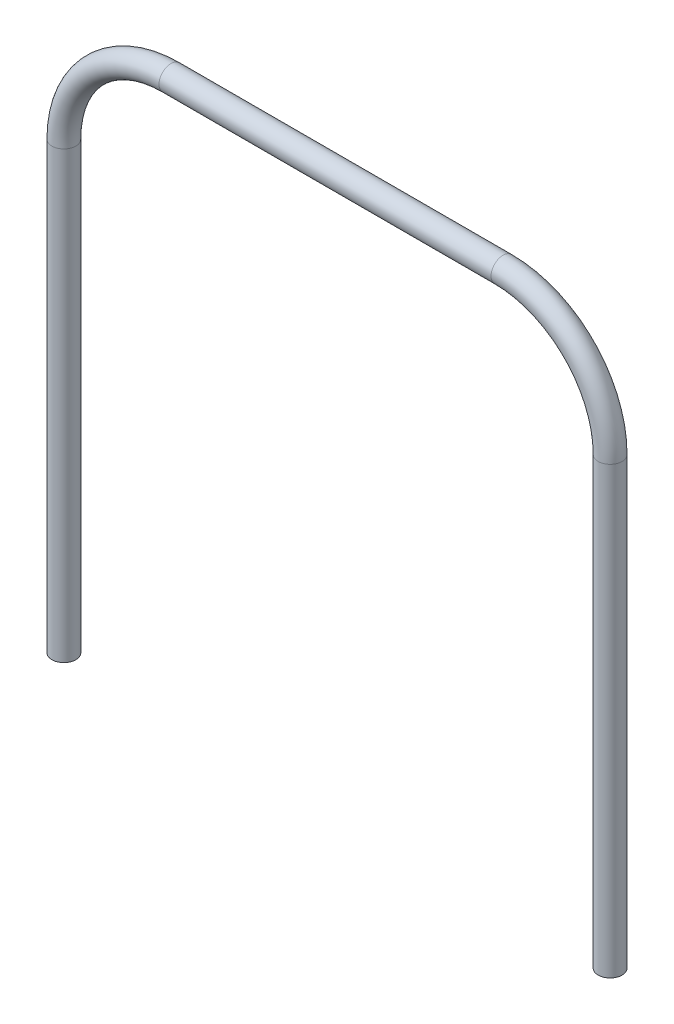
from build123d import *

# Parameters (mm, degrees)
SKETCH2_R   = 19
SKETCH2_R_2 = 17.8


with BuildPart() as part:
    # Sweep1: sweep along a path in Sketch1
    with BuildLine(Plane.XY) as sweep1_path:
        Line((0, 0), (0, 706))
        ThreePointArc((0, 706), (49.791847198, 826.208152802), (170, 876))
        Line((170, 876), (697, 876))
        ThreePointArc((697, 876), (817.208152802, 826.208152802), (867, 706))
        Line((867, 706), (867, 0))
    # Sketch2 → Sweep1 (sweep)
    with BuildSketch(Plane(origin=(0, 0, 0), x_dir=(1, 0, 0), z_dir=(0, 1, 0))):
        Circle(SKETCH2_R)
        Circle(SKETCH2_R_2, mode=Mode.SUBTRACT)
    sweep(path=sweep1_path.line)


solid = part.part
